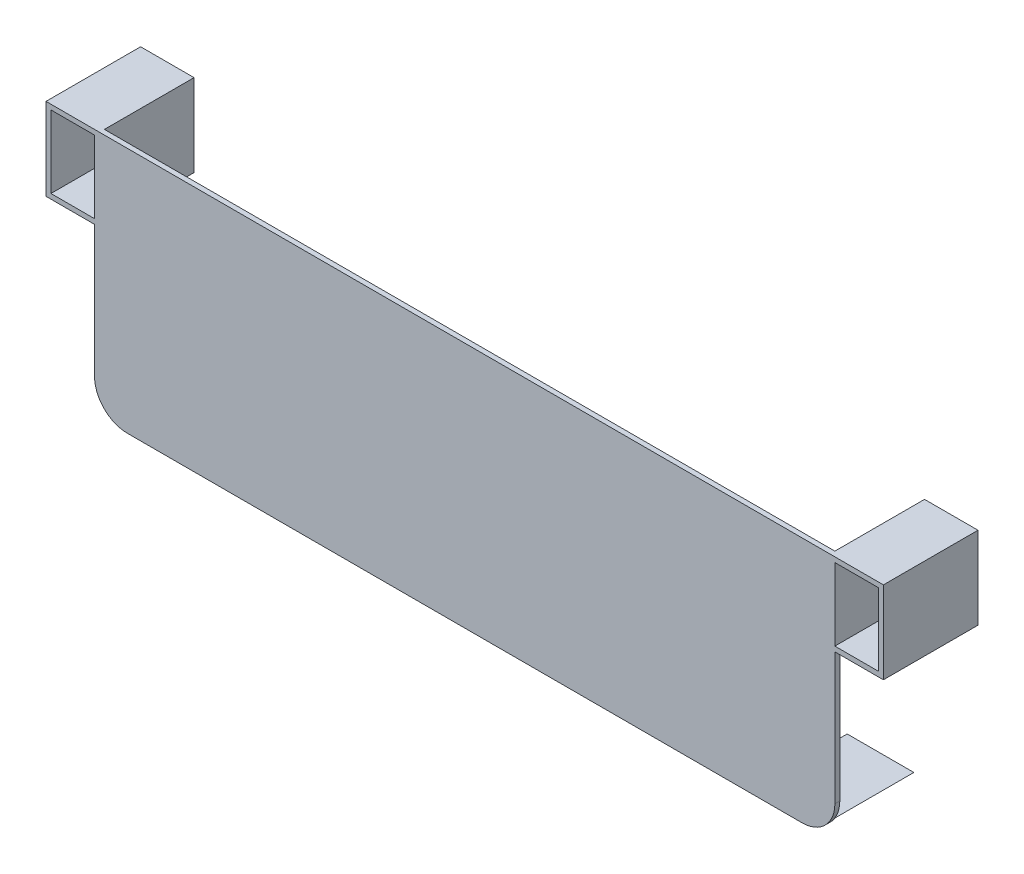
from build123d import *

# Parameters (mm, degrees)
CROQUIS1_W              = 180
CROQUIS1_H              = 60
SALIENTE_EXTRUIR1_DEPTH = 1.2
CROQUIS2_W              = 20
CROQUIS2_H              = 1.2
CROQUIS2_W_2            = 13
CROQUIS2_H_2            = 20
CROQUIS2_W_3            = 10.6
CROQUIS2_H_3            = 17.6
SALIENTE_EXTRUIR2_DEPTH = 23
REDONDEO1_R             = 8


with BuildPart() as part:
    # Croquis1 → Saliente-Extruir1 (new body)
    with BuildSketch(Plane.XY):
        with Locations((-124.847250917, 17.903225806)):
            Rectangle(CROQUIS1_W, CROQUIS1_H)
    extrude(amount=SALIENTE_EXTRUIR1_DEPTH)

    # Croquis2 → Saliente-Extruir2 (add)
    # profile 1 of 4: a face of its own
    with BuildSketch(Plane.XY.offset(1.2)):
        with Locations((-204.847250917, -11.496774194)):
            Rectangle(CROQUIS2_W, CROQUIS2_H)
    # profile 2 of 4: a face of its own
    with BuildSketch(Plane.XY.offset(1.2)):
        with Locations((-220.147250917, 37.903225806)):
            Rectangle(CROQUIS2_W_2, CROQUIS2_H_2)
        with Locations((-220.147250917, 37.903225806)):
            Rectangle(CROQUIS2_W_3, CROQUIS2_H_3, mode=Mode.SUBTRACT)
    # profile 3 of 4: a face of its own
    with BuildSketch(Plane.XY.offset(1.2)):
        with Locations((-29.547250917, 37.903225806)):
            Rectangle(CROQUIS2_W_2, CROQUIS2_H_2)
        with Locations((-29.547250917, 37.903225806)):
            Rectangle(CROQUIS2_W_3, CROQUIS2_H_3, mode=Mode.SUBTRACT)
    # profile 4 of 4: a face of its own
    with BuildSketch(Plane.XY.offset(1.2)):
        with Locations((-44.847250917, -11.496774194)):
            Rectangle(CROQUIS2_W, CROQUIS2_H)
    extrude(amount=-SALIENTE_EXTRUIR2_DEPTH)

    # Redondeo1
    redondeo1_edges = [part.edges().sort_by_distance(p)[0] for p in [
        (-34.847250917, -12.096774194, -10.3),
        (-214.847250917, -12.096774194, -10.3),
    ]]
    fillet(redondeo1_edges, radius=REDONDEO1_R)


solid = part.part
